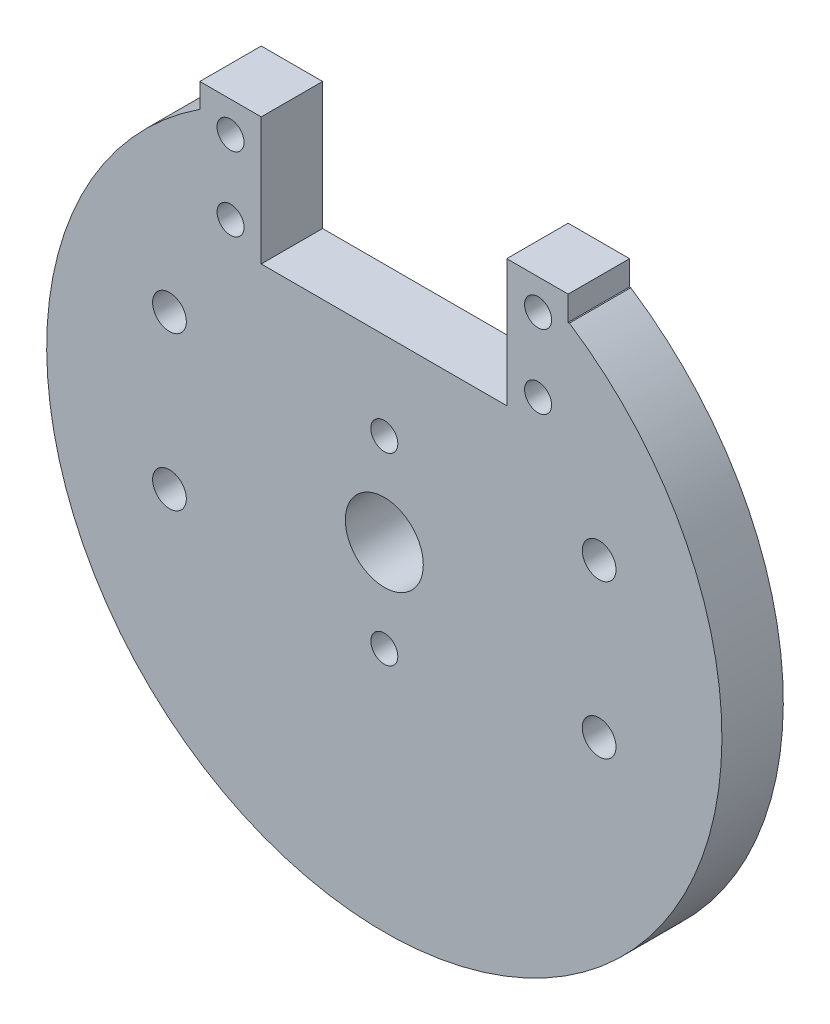
from build123d import *

# Parameters (mm, degrees)
SKETCH1_R           = 55
EXTRUDE_3_8_DEPTH   = 10
CUT_EXTRUDE1_DEPTH  = 10
SKETCH3_W           = 10
SKETCH3_H           = 20.75
BOSS_EXTRUDE2_DEPTH = 10
SKETCH4_R           = 2.2
M4_THROUGH_DEPTH    = 10
SKETCH5_R           = 6.35
CUT_EXTRUDE2_DEPTH  = 10
SKETCH6_R           = 2.2
M4_THROUGH2_DEPTH   = 10
SKETCH7_R           = 2.75
M5_THROUGH_DEPTH    = 10


with BuildPart() as part:
    # Sketch1 → 3/8 (new body)
    with BuildSketch(Plane.XY):
        Circle(SKETCH1_R)
    extrude(amount=EXTRUDE_3_8_DEPTH)

    # Sketch2 → Cut-Extrude1 (cut)
    with BuildSketch(Plane.XY.offset(10)):
        Polygon((-20.05060394, 46), (-20.05060394, 29.25), (19.94939606, 29.25), (19.94939606, 46), (30.149626863, 46), (30.149626863, 76.355115637), (-30.149626863, 76.355115637), (-30.149626863, 46), align=None)
    extrude(amount=-CUT_EXTRUDE1_DEPTH, mode=Mode.SUBTRACT)

    # Sketch3 → Boss-Extrude2 (add)
    with BuildSketch(Plane.XY.offset(10)):
        with Locations((-25.05060394, 39.625)):
            Rectangle(SKETCH3_W, SKETCH3_H)
        with Locations((24.94939606, 39.625)):
            Rectangle(SKETCH3_W, SKETCH3_H)
    extrude(amount=-BOSS_EXTRUDE2_DEPTH)

    # Sketch4 → M4_through (cut)
    with BuildSketch(Plane.XY.offset(10)):
        with Locations((-25.05060394, 45)):
            Circle(SKETCH4_R)
        with Locations((-25.05060394, 33)):
            Circle(SKETCH4_R)
        with Locations((25.05060394, 33)):
            Circle(SKETCH4_R)
        with Locations((25.05060394, 45)):
            Circle(SKETCH4_R)
    extrude(amount=-M4_THROUGH_DEPTH, mode=Mode.SUBTRACT)

    # Sketch5 → Cut-Extrude2 (cut)
    with BuildSketch(Plane.XY.offset(10)):
        Circle(SKETCH5_R)
    extrude(amount=-CUT_EXTRUDE2_DEPTH, mode=Mode.SUBTRACT)

    # Sketch6 → M4_through2 (cut)
    with BuildSketch(Plane.XY.offset(10)):
        with Locations((0, 15)):
            Circle(SKETCH6_R)
        with Locations((0, -15)):
            Circle(SKETCH6_R)
    extrude(amount=-M4_THROUGH2_DEPTH, mode=Mode.SUBTRACT)

    # Sketch7 → M5_through (cut)
    with BuildSketch(Plane.XY.offset(10)):
        with Locations((-35, 15)):
            Circle(SKETCH7_R)
        with Locations((-35, -10)):
            Circle(SKETCH7_R)
        with Locations((35, -10)):
            Circle(SKETCH7_R)
        with Locations((35, 15)):
            Circle(SKETCH7_R)
    extrude(amount=-M5_THROUGH_DEPTH, mode=Mode.SUBTRACT)


solid = part.part
